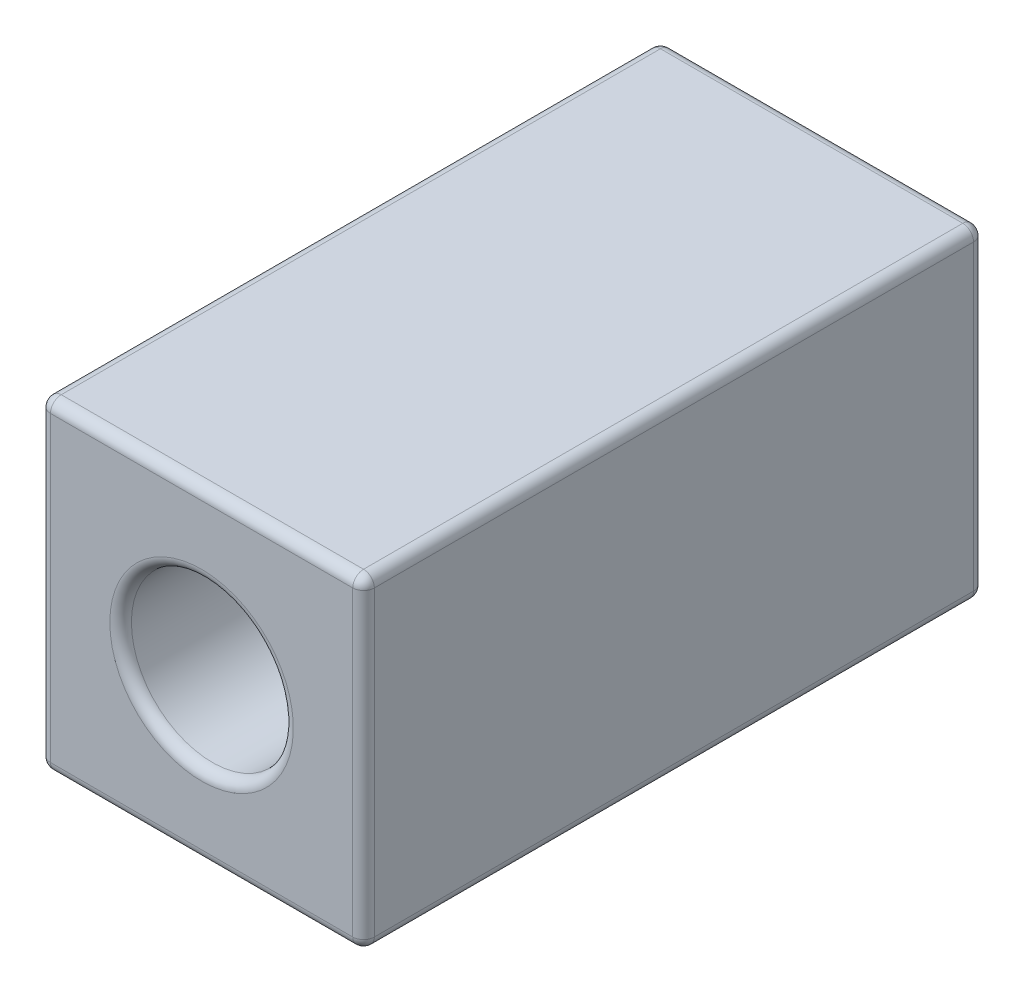
from build123d import *

# Parameters (mm, degrees)
ESQUISSE1_R      = 1.5
EXTRUSION1_DEPTH = 11.5
CONG_1_R         = 0.2


with BuildPart() as part:
    # Esquisse1 → Extrusion1 (new body)
    with BuildSketch(Plane.XY):
        with BuildLine():
            Line((-2.8, 3), (2.8, 3))
            ThreePointArc((2.8, 3), (2.941421356, 2.941421356), (3, 2.8))
            Line((3, 2.8), (3, -2.8))
            ThreePointArc((3, -2.8), (2.941421356, -2.941421356), (2.8, -3))
            Line((2.8, -3), (-2.8, -3))
            ThreePointArc((-2.8, -3), (-2.941421356, -2.941421356), (-3, -2.8))
            Line((-3, -2.8), (-3, 2.8))
            ThreePointArc((-3, 2.8), (-2.941421356, 2.941421356), (-2.8, 3))
        make_face()
        with Locations(Location((0, 0, 0), (0, 0, 180))):
            Circle(ESQUISSE1_R, mode=Mode.SUBTRACT)
    extrude(amount=EXTRUSION1_DEPTH)

    # Congé1
    cong_1_edges = [part.edges().sort_by_distance(p)[0] for p in [
        (0, 3, 0),
        (0, 3, 11.5),
        (2.941421356, 2.941421356, 0),
        (2.941421356, 2.941421356, 11.5),
        (3, 0, 0),
        (3, 0, 11.5),
        (2.941421356, -2.941421356, 0),
        (2.941421356, -2.941421356, 11.5),
        (0, -3, 0),
        (0, -3, 11.5),
        (-2.941421356, -2.941421356, 0),
        (-2.941421356, -2.941421356, 11.5),
        (-3, 0, 0),
        (-3, 0, 11.5),
        (-2.941421356, 2.941421356, 0),
        (-2.941421356, 2.941421356, 11.5),
        (1.5, 0, 0),
        (1.5, 0, 11.5),
    ]]
    fillet(cong_1_edges, radius=CONG_1_R)


solid = part.part
